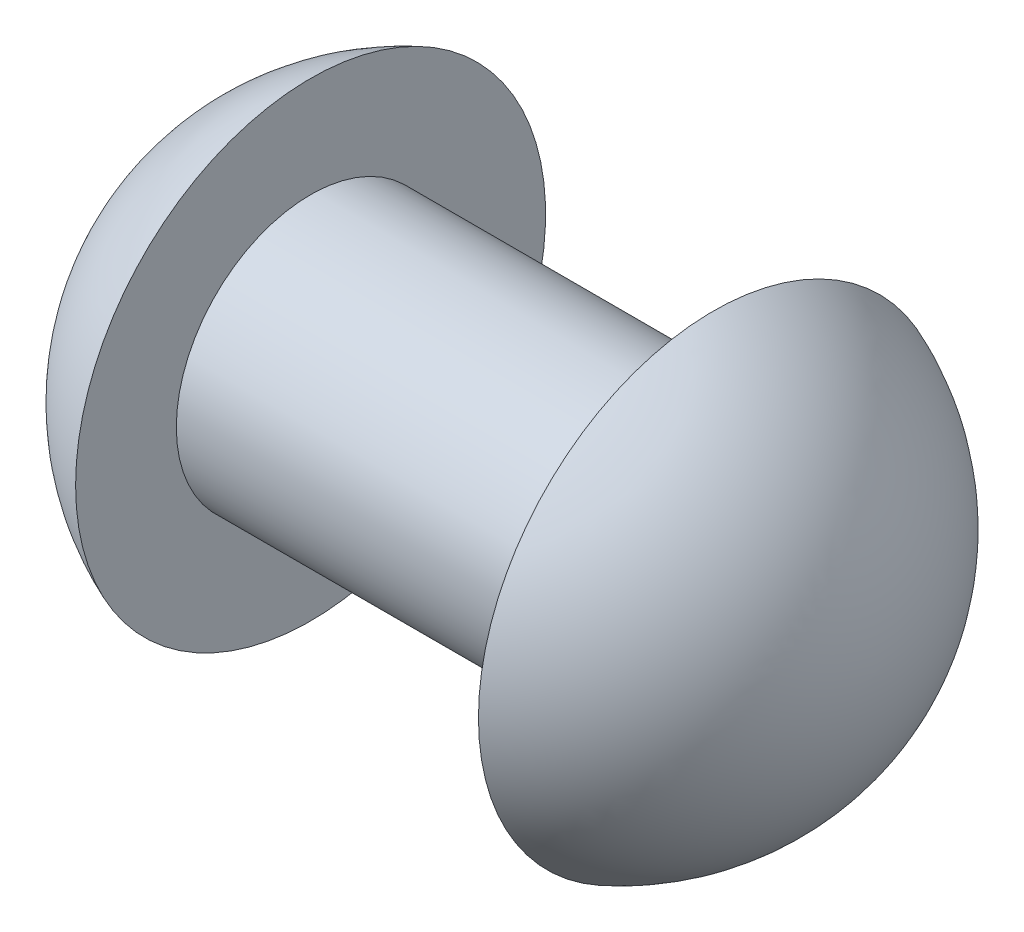
from build123d import *

# Parameters (mm, degrees)
SCALE1_SCALE = 0.1


with BuildPart() as part:
    # Sketch1 → Base-Revolve (revolve)
    with BuildSketch(Plane.XY, mode=Mode.PRIVATE) as base_revolve_sk:
        with BuildLine():
            Line((-4.2, 0), (0, 0))
            Line((0, 0), (0, 1))
            Line((0, 1), (-3, 1))
            Line((-3, 1), (-3, 1.75))
            ThreePointArc((-3, 1.75), (-3.867055428, 1.058123722), (-4.2, 0))
        make_face()
    revolve(base_revolve_sk.sketch.rotate(Axis((-39, 0, 0), (1, 0, 0)), 90), axis=Axis((-39, 0, 0), (1, 0, 0)))

    # Sketch3 → HeadTypeA (revolve)
    with BuildSketch(Plane.XY):
        with BuildLine():
            Line((0, 0), (1.2, 0))
            ThreePointArc((1.2, 0), (0.867055428, 1.058123722), (0, 1.75))
            Line((0, 1.75), (0, 0))
        make_face()
    revolve(axis=Axis((-49, 0, 0), (1, 0, 0)))


with BuildPart() as part_1:
    # Scale1: scaled about (-1.5, 0, 0)
    add(part.part.scale(SCALE1_SCALE).moved(Location((-1.35, 0, 0))))


solid = part_1.part
